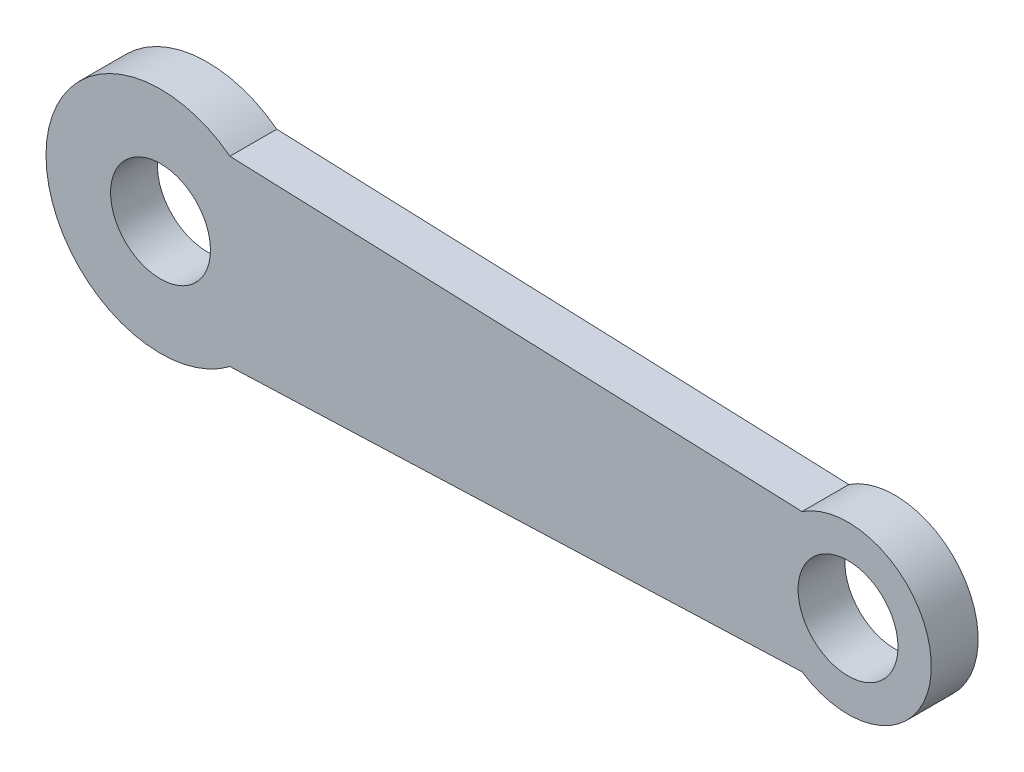
from build123d import *

# Parameters (mm, degrees)
SKETCH1_R           = 11
BOSS_EXTRUDE1_DEPTH = 2.25
SKETCH2_R           = 8
BOSS_EXTRUDE2_DEPTH = 2.25
BOSS_EXTRUDE3_DEPTH = 2.25
SKETCH4_R           = 4.8
CUT_EXTRUDE1_DEPTH  = 4.5


with BuildPart() as part:
    # Sketch1 → Boss-Extrude1 (new, symmetric)
    with BuildSketch(Plane.XY):
        Circle(SKETCH1_R)
    extrude(amount=BOSS_EXTRUDE1_DEPTH, both=True)



with BuildPart() as body_2:
    # Sketch2 → Boss-Extrude2 (new, symmetric)
    with BuildSketch(Plane.XY):
        with Locations((66.0482, 0)):
            Circle(SKETCH2_R)
    extrude(amount=BOSS_EXTRUDE2_DEPTH, both=True)


with BuildPart() as part_1:
    add(part.part)

    add(body_2.part)  # Boss-Extrude3 merges body 2
    # Sketch3 → Boss-Extrude3 (add, symmetric)
    with BuildSketch(Plane.XY):
        Polygon((0, -9), (66.0482, -6.5), (66.0482, 6.5), (0, 9), align=None)
    extrude(amount=BOSS_EXTRUDE3_DEPTH, both=True)

    # Sketch4 → Cut-Extrude1 (cut, symmetric)
    with BuildSketch(Plane.XY):
        Circle(SKETCH4_R)
        with Locations((66.0482, 0)):
            Circle(SKETCH4_R)
    extrude(amount=CUT_EXTRUDE1_DEPTH, both=True, mode=Mode.SUBTRACT)


solid = part_1.part
